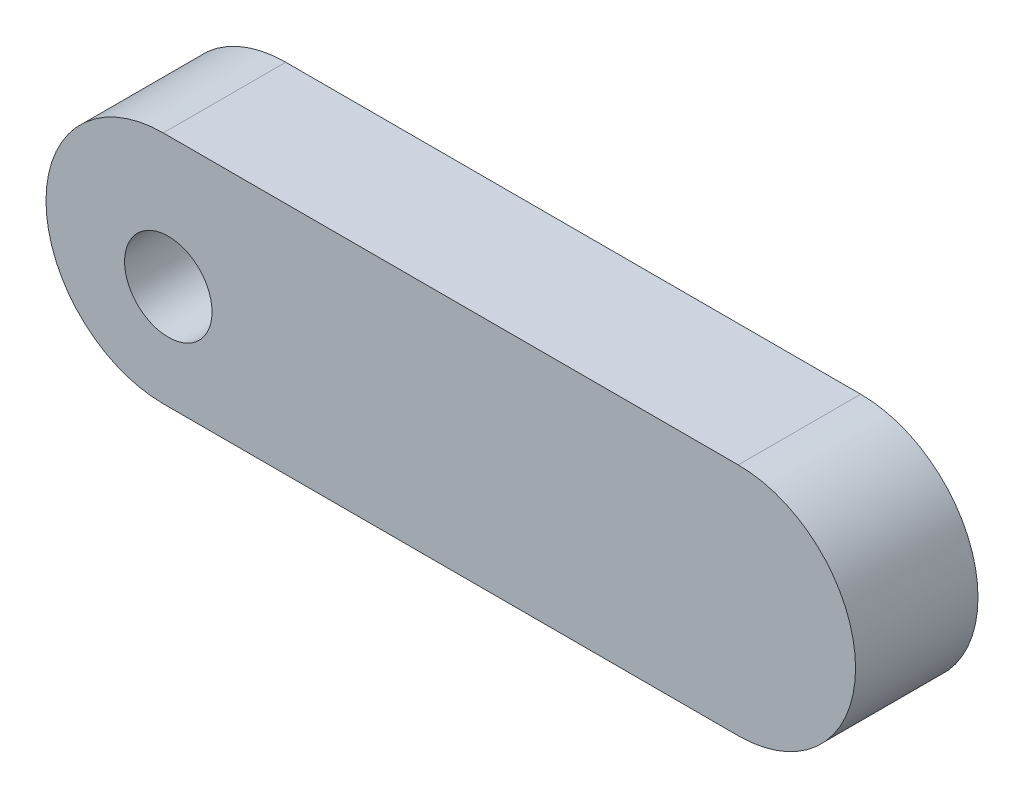
from build123d import *

# Parameters (mm, degrees)
EXTRUDE_1_DEPTH     = 10
SKETCH_2_R          = 3.570561941
CUT_EXTRUDE_1_DEPTH = 10


with BuildPart() as part:
    # 草图1 → 凸台-拉伸1 (new body)
    with BuildSketch(Plane.XY):
        with BuildLine():
            Line((-68.643442379, 31.377054714), (-21.691703406, 31.377054714))
            ThreePointArc((-21.691703406, 31.377054714), (-12.113548655, 21.798899964), (-21.691703406, 12.220745213))
            Line((-21.691703406, 12.220745213), (-68.643442379, 12.220745213))
            ThreePointArc((-68.643442379, 12.220745213), (-78.221597129, 21.798899964), (-68.643442379, 31.377054714))
        make_face()
    extrude(amount=EXTRUDE_1_DEPTH)

    # 草图2 → 切除-拉伸1 (cut)
    with BuildSketch(Plane.XY.offset(10)):
        with Locations((-68.234052305, 20.707203992)):
            Circle(SKETCH_2_R)
    extrude(amount=-CUT_EXTRUDE_1_DEPTH, mode=Mode.SUBTRACT)


solid = part.part
